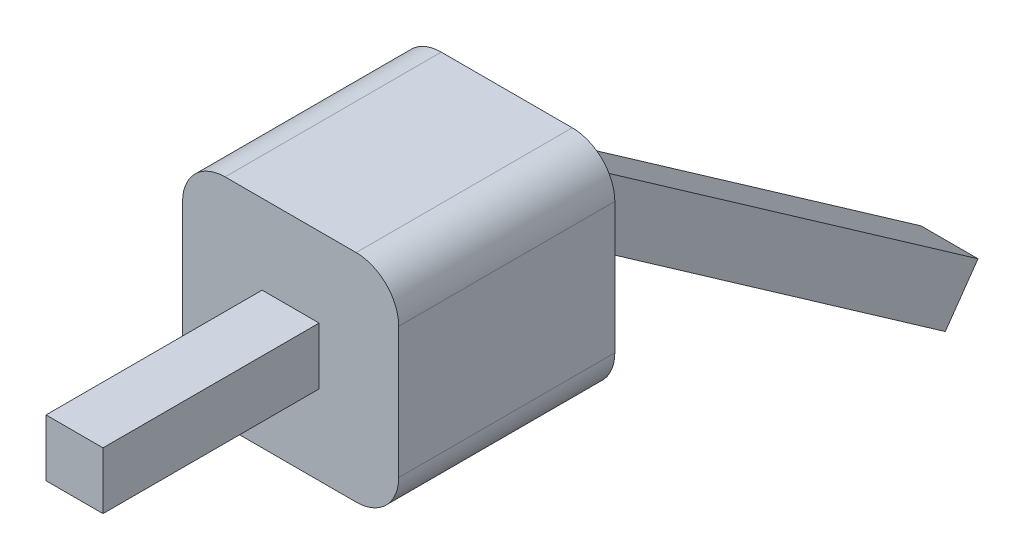
from build123d import *

# Parameters (mm, degrees)
SKETCH_1_W      = 2.54
SKETCH_1_H      = 2.54
EXTRUDE_1_DEPTH = 2.54
SKETCH_2_W      = 0.67
SKETCH_2_H      = 0.67
FILLET_1_R      = 0.5


with BuildPart() as part:
    # 草图1 → 拉伸1 (new body)
    with BuildSketch(Plane.XY):
        with Locations((0, -1.289090726)):
            Rectangle(SKETCH_1_W, SKETCH_1_H)
    extrude(amount=EXTRUDE_1_DEPTH)

    # 扫描1: sweep along a path in 草图3
    with BuildLine(Plane(origin=(0, 0, 0), x_dir=(0, 0, -1), z_dir=(1, 0, 0))) as sweep_1_path:
        Line((-5.08, -1.299090726), (0.5, -1.299090726))
        Line((0.5, -1.299090726), (5.005336244, -4.453761126))
    # 草图2 → 扫描1 (sweep)
    with BuildSketch(Plane(origin=(0, 0, 5.08), x_dir=(-1, 0, 0), z_dir=(0, 0, -1))):
        with Locations((0, -1.289090726)):
            Rectangle(SKETCH_2_W, SKETCH_2_H)
    sweep(path=sweep_1_path.line, transition=Transition.RIGHT)

    # 圆角1
    fillet_1_edges = [part.edges().sort_by_distance(p)[0] for p in [
        (-1.27, -0.019090726, 1.27),
        (1.27, -0.019090726, 1.27),
        (1.27, -2.559090726, 1.27),
        (-1.27, -2.559090726, 1.27),
    ]]
    fillet(fillet_1_edges, radius=FILLET_1_R)


solid = part.part
